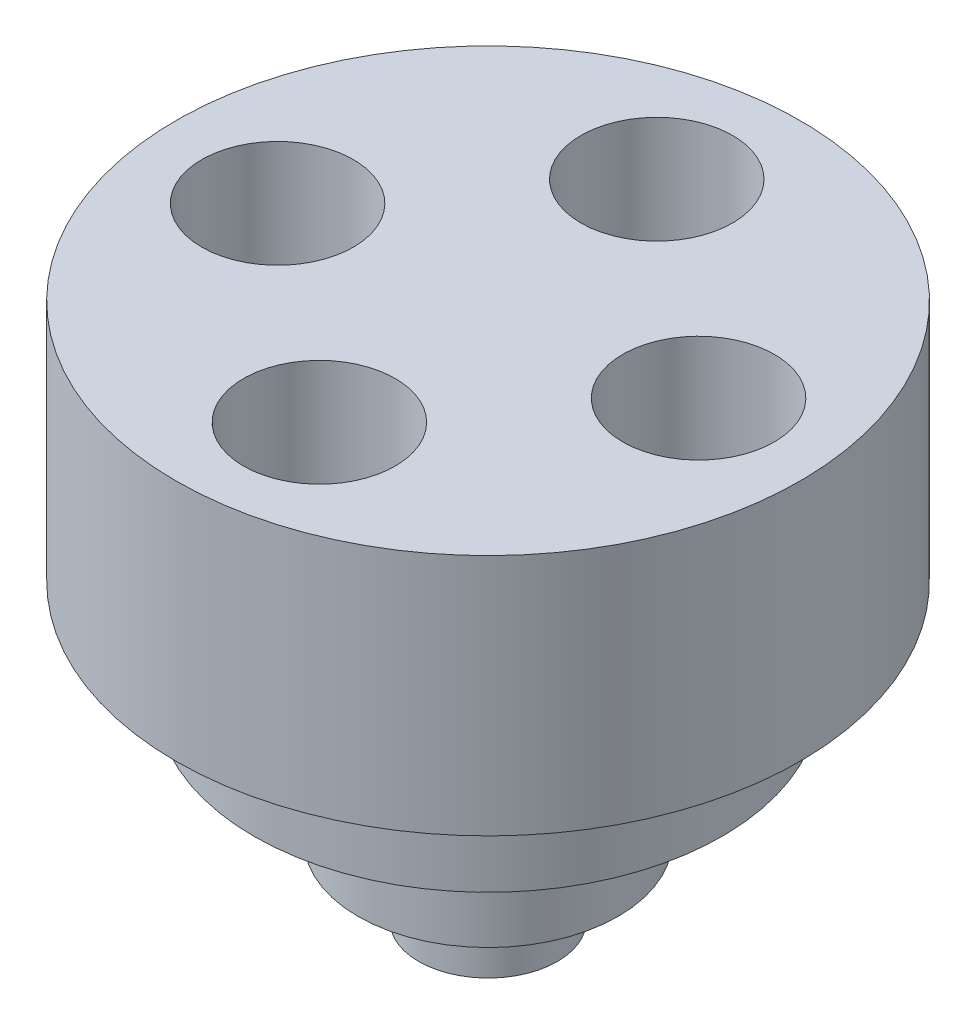
from build123d import *

# Parameters (mm, degrees)
SKETCH_1_R          = 9.525
EXTRUDE_1_DEPTH     = 16.51
SKETCH_2_R          = 22.86
EXTRUDE_2_DEPTH     = 17.78
CUT_EXTRUDE_1_DEPTH = 10.16
SKETCH_3_R          = 5.55625
CUT_EXTRUDE_2_DEPTH = 11.1125
SKETCH_5_R          = 1.55
CUT_EXTRUDE_3_DEPTH = 32
SKETCH_6_W          = 7.62
SKETCH_6_H          = 7.62
EXTRUDE_START       = 5.08
SKETCH_7_R          = 5.08
EXTRUDE_3_DEPTH     = 5.08


with BuildPart() as part:
    # 草图1 → 凸台-拉伸1 (new body)
    with BuildSketch(Plane(origin=(0, 0, 0), x_dir=(1, 0, 0), z_dir=(0, 1, 0))):
        with Locations(Location((0, 0, 0), (0, 0, 270))):
            Circle(SKETCH_1_R)
    extrude(amount=EXTRUDE_1_DEPTH)

    # 草图2 → 凸台-拉伸2 (add)
    with BuildSketch(Plane(origin=(0, 16.51, 0), x_dir=(1, 0, 0), z_dir=(0, 1, 0))):
        with Locations(Location((0, 0, 0), (0, 0, 270))):
            Circle(SKETCH_2_R)
    extrude(amount=EXTRUDE_2_DEPTH)

    # 草图4 → 切除-拉伸1 (cut)
    with BuildSketch(Plane.XZ):
        with BuildLine():
            Line((3.080497473, 0.768869508), (0.87438821, 3.052223822))
            ThreePointArc((0.87438821, 3.052223822), (-2.283354313, -2.206109263), (3.080497473, 0.768869508))
        make_face()
    extrude(amount=-CUT_EXTRUDE_1_DEPTH, mode=Mode.SUBTRACT)

    # 草图3 → 切除-拉伸2 (cut)
    with BuildSketch(Plane(origin=(0, 34.29, 0), x_dir=(1, 0, 0), z_dir=(0, 1, 0))):
        with Locations(Location((-13.885899292, -1.530588399, 0), (0, 0, 270))):
            Circle(SKETCH_3_R)
        with Locations(Location((-1.530588399, 13.885899292, 0), (0, 0, 270))):
            Circle(SKETCH_3_R)
        with Locations(Location((13.885899292, 1.530588399, 0), (0, 0, 270))):
            Circle(SKETCH_3_R)
        with Locations(Location((1.530588399, -13.885899292, 0), (0, 0, 270))):
            Circle(SKETCH_3_R)
    extrude(amount=-CUT_EXTRUDE_2_DEPTH, mode=Mode.SUBTRACT)

    # 草图5 → 切除-拉伸3 (cut)
    with BuildSketch(Plane(origin=(-7.155974413, 0, -6.913890386), x_dir=(-0.6948375630636291, 0, 0.7191667129086254), z_dir=(-0.7191667129086254, 0, -0.6948375630636291))):
        with Locations((0, 5.08)):
            Circle(SKETCH_5_R)
    extrude(amount=-CUT_EXTRUDE_3_DEPTH, mode=Mode.SUBTRACT)

    # 草图6 → 旋转2 (revolve)
    with BuildSketch(Plane(origin=(0, 0, 0), x_dir=(-0.9998520121667556, 0, 0.01720330683589877), z_dir=(-0.01720330683589877, 0, -0.9998520121667556)), mode=Mode.PRIVATE) as revolve_2_sk:
        with Locations((-13.335, 12.7)):
            Rectangle(SKETCH_6_W, SKETCH_6_H)
    revolve(revolve_2_sk.sketch.rotate(Axis((0, 16.51, 0), (0, -1, 0)), 90.985725501), axis=Axis((0, 16.51, 0), (0, -1, 0)))

    # 草图7 → 凸台-拉伸3 (add)
    with BuildSketch(Plane.XZ.offset(EXTRUDE_START)):
        with Locations(Location((0, 0, 0), (0, 0, 90))):
            Circle(SKETCH_7_R)
        with BuildLine():
            Line((0.87438821, 3.052223822), (3.080497473, 0.768869508))
            ThreePointArc((3.080497473, 0.768869508), (-2.283354313, -2.206109263), (0.87438821, 3.052223822))
        make_face(mode=Mode.SUBTRACT)
    extrude(amount=-EXTRUDE_3_DEPTH)


solid = part.part
